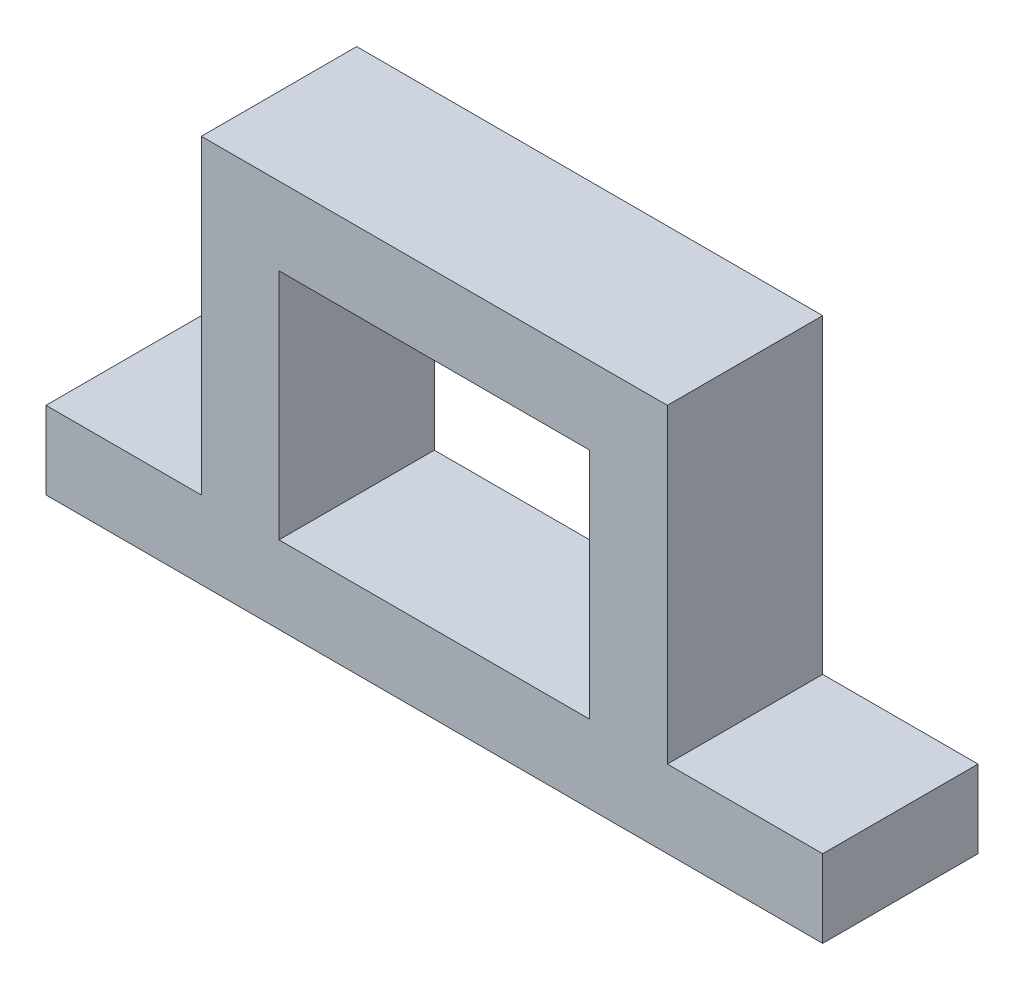
from build123d import *

# Parameters (mm, degrees)
SKETCH1_W               = 30
SKETCH1_H               = 25
BOSS_EXTRUDE1_DEPTH     = 10
SKETCH2_W               = 50
SKETCH2_H               = 5
BOSS_EXTRUDE2_DEPTH     = 10
CUT_EXTRUDE1_DEPTH      = 49.218253805
CUT_EXTRUDE1_DEPTH_BACK = 49.218253805
SKETCH3_W               = 20
SKETCH3_H               = 15


with BuildPart() as part:
    # Sketch1 → Boss-Extrude1 (new body)
    with BuildSketch(Plane.XY):
        with Locations((15, 12.5)):
            Rectangle(SKETCH1_W, SKETCH1_H)
    extrude(amount=BOSS_EXTRUDE1_DEPTH)

    # Sketch2 → Boss-Extrude2 (add)
    with BuildSketch(Plane.XY.offset(10)):
        with Locations((15, 2.5)):
            Rectangle(SKETCH2_W, SKETCH2_H)
    extrude(amount=-BOSS_EXTRUDE2_DEPTH)

    # Sketch3 → Cut-Extrude1 (cut, two sides: drawn at the far end of the back side and taken through both)
    with BuildSketch(Plane.XY.offset(10).offset(-CUT_EXTRUDE1_DEPTH_BACK)):
        with Locations((15, 12.5)):
            Rectangle(SKETCH3_W, SKETCH3_H)
    extrude(amount=CUT_EXTRUDE1_DEPTH + CUT_EXTRUDE1_DEPTH_BACK, mode=Mode.SUBTRACT)


solid = part.part
